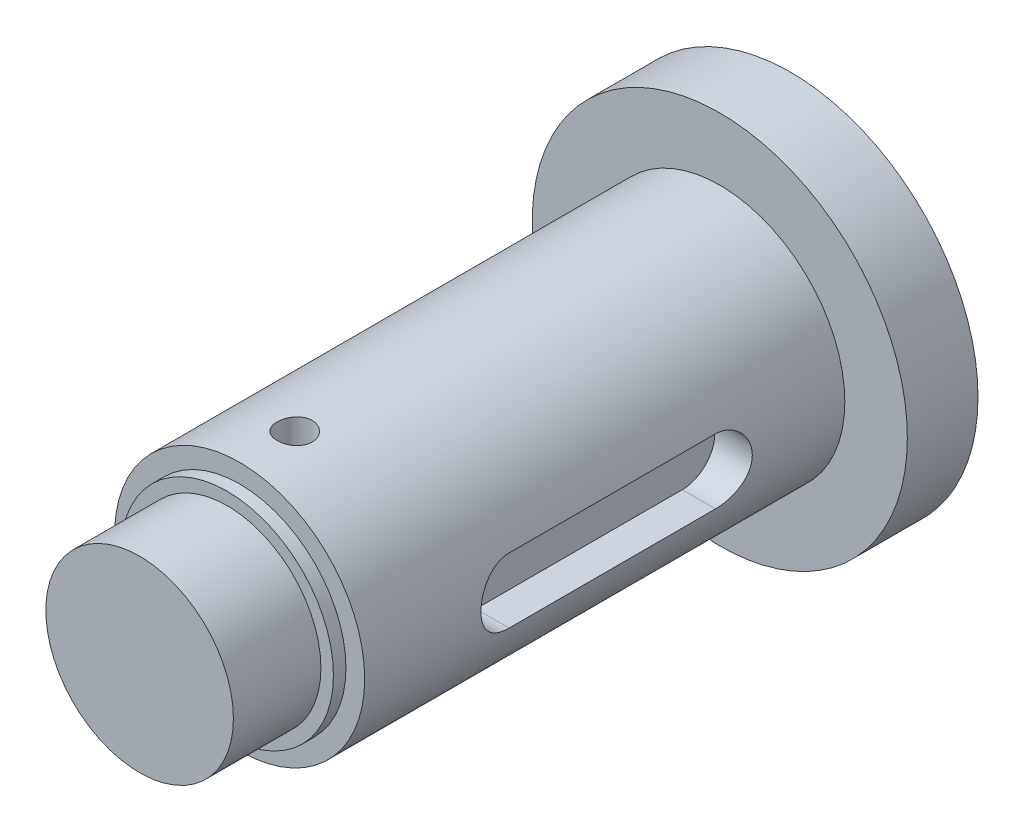
from build123d import *

# Parameters (mm, degrees)
SKETCH_1_R          = 15
EXTRUDE_1_DEPTH     = 5.65
SKETCH_2_R          = 10
EXTRUDE_2_DEPTH     = 46.4
SKETCH_3_R          = 1.25
CUT_EXTRUDE_1_DEPTH = 10
SKETCH_4_OUTSIDE_W  = 45.43
SKETCH_4_OUTSIDE_H  = 45.43
SKETCH_4_OUTSIDE_R  = 7.5
CUT_EXTRUDE_2_DEPTH = 7
SKETCH_5_OUTSIDE_W  = 45.43
SKETCH_5_OUTSIDE_H  = 45.43
SKETCH_5_OUTSIDE_R  = 8.5
CUT_EXTRUDE_3_DEPTH = 1
SKETCH_6_R          = 1.4
CUT_EXTRUDE_4_DEPTH = 8
CUT_EXTRUDE_5_DEPTH = 3


with BuildPart() as part:
    # 草图1 → 凸台-拉伸1 (new body)
    with BuildSketch(Plane.XY):
        Circle(SKETCH_1_R)
    extrude(amount=EXTRUDE_1_DEPTH)

    # 草图2 → 凸台-拉伸2 (add)
    with BuildSketch(Plane.XY.offset(5.65)):
        Circle(SKETCH_2_R)
    extrude(amount=EXTRUDE_2_DEPTH)

    # 草图3 → 切除-拉伸1 (cut)
    with BuildSketch(Plane(origin=(0, 0, 0), x_dir=(-1, 0, 0), z_dir=(0, 0, -1))):
        with Locations((0, 7)):
            Circle(SKETCH_3_R)
        with Locations((7, 0)):
            Circle(SKETCH_3_R)
        with Locations((0, -7)):
            Circle(SKETCH_3_R)
        with Locations((-7, 0)):
            Circle(SKETCH_3_R)
    extrude(amount=-CUT_EXTRUDE_1_DEPTH, mode=Mode.SUBTRACT)

    # 草图4 outside → 切除-拉伸2 (cut)
    with BuildSketch(Plane.XY.offset(52.05)):
        Rectangle(SKETCH_4_OUTSIDE_W, SKETCH_4_OUTSIDE_H)
        Circle(SKETCH_4_OUTSIDE_R, mode=Mode.SUBTRACT)
    extrude(amount=-CUT_EXTRUDE_2_DEPTH, mode=Mode.SUBTRACT)

    # 草图5 outside → 切除-拉伸3 (cut)
    with BuildSketch(Plane.XY.offset(45.05)):
        Rectangle(SKETCH_5_OUTSIDE_W, SKETCH_5_OUTSIDE_H)
        Circle(SKETCH_5_OUTSIDE_R, mode=Mode.SUBTRACT)
    extrude(amount=-CUT_EXTRUDE_3_DEPTH, mode=Mode.SUBTRACT)

    # 草图6 → 切除-拉伸4 (cut)
    with BuildSketch(Plane(origin=(0, 10, 0), x_dir=(1, 0, 0), z_dir=(0, 1, 0))):
        with Locations(Location((0, -39.65, 0), (0, 0, 270))):
            Circle(SKETCH_6_R)
    cut_extrude_4 = extrude(amount=-CUT_EXTRUDE_4_DEPTH, mode=Mode.SUBTRACT)

    # 镜向1: 切除-拉伸4 across plane
    add(cut_extrude_4.mirror(Plane.ZX), mode=Mode.SUBTRACT)

    # 草图7 → 切除-拉伸5 (cut)
    with BuildSketch(Plane(origin=(10, 0, 0), x_dir=(0, 0, -1), z_dir=(1, 0, 0))):
        with BuildLine():
            Line((-32.15, 2.6), (-15.65, 2.6))
            ThreePointArc((-15.65, 2.6), (-13.05, 0), (-15.65, -2.6))
            Line((-15.65, -2.6), (-32.15, -2.6))
            ThreePointArc((-32.15, -2.6), (-34.75, 0), (-32.15, 2.6))
        make_face()
    extrude(amount=-CUT_EXTRUDE_5_DEPTH, mode=Mode.SUBTRACT)


solid = part.part
